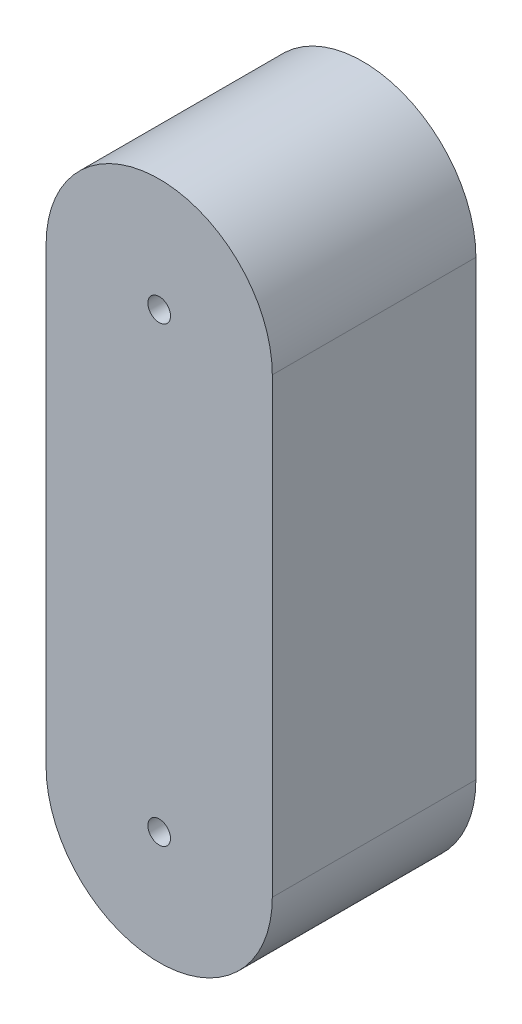
from build123d import *

# Parameters (mm, degrees)
SKIZZE1_R                       = 5
AUFSATZ_LINEAR_AUSTRAGEN1_DEPTH = 90


with BuildPart() as part:
    # Skizze1 → Aufsatz-Linear austragen1 (new body)
    with BuildSketch(Plane.XY):
        with BuildLine():
            Line((-50, 200), (-50, 0))
            ThreePointArc((-50, 0), (0, -50), (50, 0))
            Line((50, 0), (50, 200))
            ThreePointArc((50, 200), (0, 250), (-50, 200))
        make_face()
        with Locations(Location((0, 0, 0), (0, 0, 180))):
            Circle(SKIZZE1_R, mode=Mode.SUBTRACT)
        with Locations(Location((0, 200, 0), (0, 0, 180))):
            Circle(SKIZZE1_R, mode=Mode.SUBTRACT)
    extrude(amount=AUFSATZ_LINEAR_AUSTRAGEN1_DEPTH)


solid = part.part
